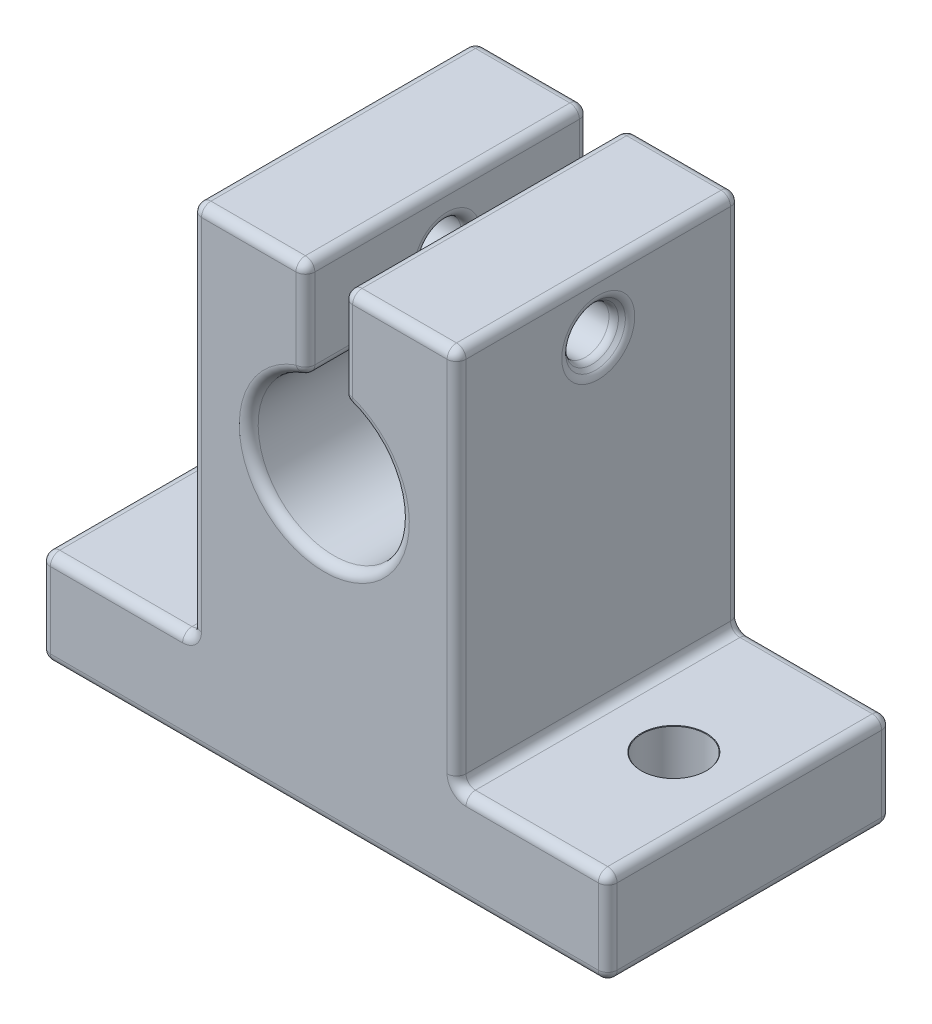
from build123d import *

# Parameters (mm, degrees)
SKETCH1_W                      = 30
SKETCH1_H                      = 15
BOSS_EXTRUDE1_DEPTH            = 5
SKETCH2_W                      = 14
SKETCH2_H                      = 15
BOSS_EXTRUDE2_DEPTH            = 20
CUT_EXTRUDE1_DEPTH             = 33.787192622
M3_TAPPED_HOLE1_D              = 2.5
M3_TAPPED_HOLE1_DEPTH          = 11.248924226
M3_TAPPED_HOLE1_CSINK_D        = 3.45
M3_TAPPED_HOLE1_CSINK_ANGLE    = 90
M3_TAPPED_HOLE1_TIP            = 0.751075774
FILLET1_R                      = 0.5
M3_CLEARANCE_HOLE1_D           = 3.4
M3_CLEARANCE_HOLE1_CSINK_D     = 3.45
M3_CLEARANCE_HOLE1_CSINK_ANGLE = 90


with BuildPart() as part:
    # Sketch1 → Boss-Extrude1 (new body)
    with BuildSketch(Plane(origin=(0, 0, 0), x_dir=(1, 0, 0), z_dir=(0, 1, 0))):
        Rectangle(SKETCH1_W, SKETCH1_H)
    extrude(amount=BOSS_EXTRUDE1_DEPTH)

    # Sketch2 → Boss-Extrude2 (add)
    with BuildSketch(Plane(origin=(0, 5, 0), x_dir=(1, 0, 0), z_dir=(0, 1, 0))):
        Rectangle(SKETCH2_W, SKETCH2_H)
    extrude(amount=BOSS_EXTRUDE2_DEPTH)

    # Sketch3 → Cut-Extrude1 (cut, through all)
    with BuildSketch(Plane.XY.offset(7.5)):
        with BuildLine():
            Line((-1, 30), (1, 30))
            Line((1, 30), (1, 19.872983346))
            ThreePointArc((1, 19.872983346), (0, 12), (-1, 19.872983346))
            Line((-1, 19.872983346), (-1, 30))
        make_face()
    extrude(amount=-CUT_EXTRUDE1_DEPTH, mode=Mode.SUBTRACT)

    # M3 Tapped Hole1
    with Locations(Plane(origin=(7, 22, 0), x_dir=(0, 0, 1), z_dir=(1, 0, 0))):
        with Locations((0, 0)):
            CounterSinkHole(M3_TAPPED_HOLE1_D / 2, M3_TAPPED_HOLE1_CSINK_D / 2, depth=M3_TAPPED_HOLE1_DEPTH, counter_sink_angle=M3_TAPPED_HOLE1_CSINK_ANGLE)
            with Locations((0, 0, -(M3_TAPPED_HOLE1_DEPTH + M3_TAPPED_HOLE1_TIP / 2))):  # 118° drill point
                Cone(0, M3_TAPPED_HOLE1_D / 2, M3_TAPPED_HOLE1_TIP, mode=Mode.SUBTRACT)

    # Fillet1
    fillet1_edges = [part.edges().sort_by_distance(p)[0] for p in [
        (-15, 5, 0),
        (-11, 5, -7.5),
        (11, 5, 7.5),
        (-11, 5, 7.5),
        (7, 5, 0),
        (7, 15, 7.5),
        (7, 15, -7.5),
        (-7, 5, 0),
        (-7, 15, -7.5),
        (-7, 15, 7.5),
        (7, 25, 0),
        (4, 25, -7.5),
        (-7, 25, 0),
        (-4, 25, 7.5),
        (-4, 25, -7.5),
        (4, 25, 7.5),
        (1, 25, 0),
        (-1, 25, 0),
        (-1, 22.436491673, -7.5),
        (-1, 19.872983346, 0),
        (1, 22.436491673, -7.5),
        (0, 12, -7.5),
        (1, 19.872983346, 0),
        (-1, 22.436491673, 7.5),
        (0, 12, 7.5),
        (1, 22.436491673, 7.5),
        (15, 5, 0),
        (0, 0, 7.5),
        (1, 22, 1.25),
        (-4.248924226, 20.75, 0),
        (-1, 22, 1.25),
        (7, 22, 1.725),
        (6.525, 22, 1.25),
        (-15, 0, 0),
        (0, 0, -7.5),
        (15, 0, 0),
        (15, 2.5, 7.5),
        (-15, 2.5, 7.5),
        (-15, 2.5, -7.5),
        (15, 2.5, -7.5),
        (11, 5, -7.5),
    ]]
    fillet(fillet1_edges, radius=FILLET1_R)

    # M3 Clearance Hole1 (through all)
    with Locations(Plane(origin=(11, 5, 0), x_dir=(0, 0, 1), z_dir=(0, 1, 0))):
        with Locations((0, 0), (0, -22.031373033)):
            CounterSinkHole(M3_CLEARANCE_HOLE1_D / 2, M3_CLEARANCE_HOLE1_CSINK_D / 2, counter_sink_angle=M3_CLEARANCE_HOLE1_CSINK_ANGLE)


solid = part.part
